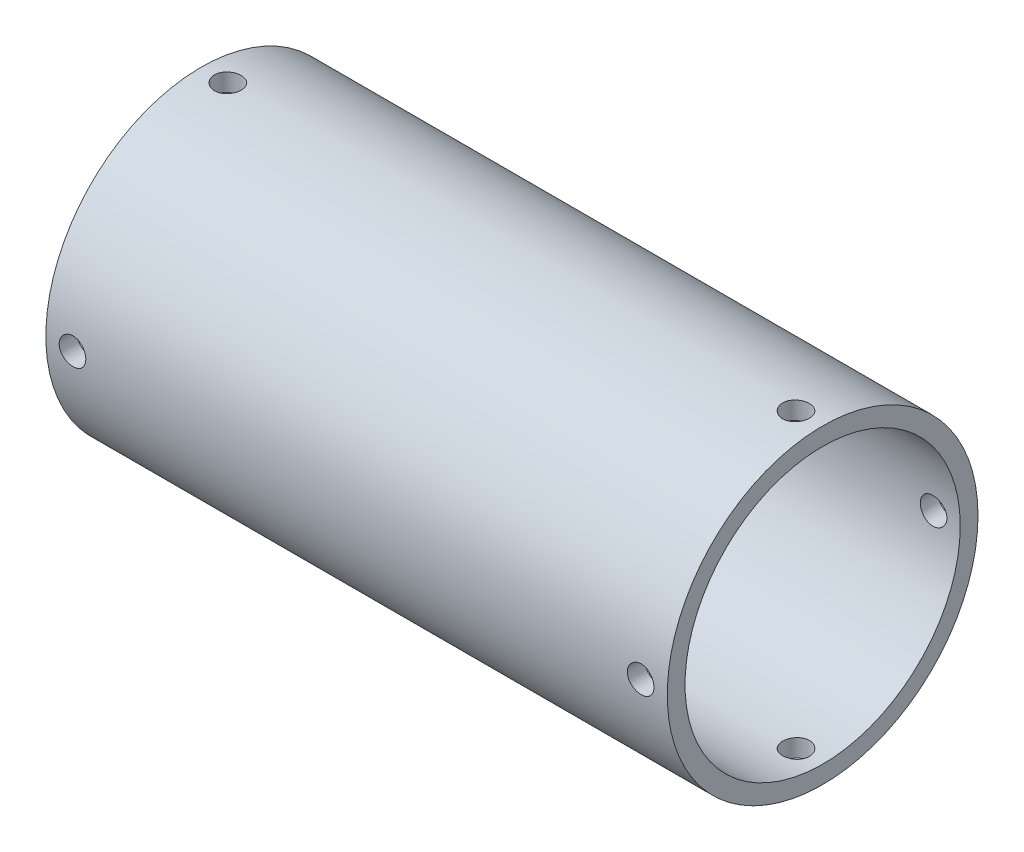
from build123d import *

# Parameters (mm, degrees)
SKETCH_1_R               = 17.5
SKETCH_1_R_2             = 15.5
EXTRUDE_1_DEPTH          = 70
SKETCH_2_R               = 1.5
CUT_EXTRUDE_1_DEPTH      = 75.246212025
PATTERN_CIRCULAR_1_COUNT = 2
PATTERN_CIRCULAR_1_ANGLE = 90


with BuildPart() as part:
    # Эскиз1 → Бобышка-Вытянуть1 (new body)
    with BuildSketch(Plane(origin=(0, 0, 0), x_dir=(0, 0, -1), z_dir=(1, 0, 0))):
        Circle(SKETCH_1_R)
        Circle(SKETCH_1_R_2, mode=Mode.SUBTRACT)
    extrude(amount=EXTRUDE_1_DEPTH)

    # Эскиз2 → Вырез-Вытянуть1 (cut, symmetric)
    with BuildSketch(Plane.XY):
        with Locations((3, 0)):
            Circle(SKETCH_2_R)
        with Locations((67, 0)):
            Circle(SKETCH_2_R)
    cut_extrude_1 = extrude(amount=CUT_EXTRUDE_1_DEPTH, both=True, mode=Mode.SUBTRACT)

    # Круговой массив1: Вырез-Вытянуть1 ×2 about axis
    pattern_circular_1_axis = Axis((9.527991342, 0, 0), (1, 0, 0))
    for i in range(1, PATTERN_CIRCULAR_1_COUNT):
        add(cut_extrude_1.rotate(pattern_circular_1_axis, i * PATTERN_CIRCULAR_1_ANGLE / (PATTERN_CIRCULAR_1_COUNT - 1)), mode=Mode.SUBTRACT)


solid = part.part
